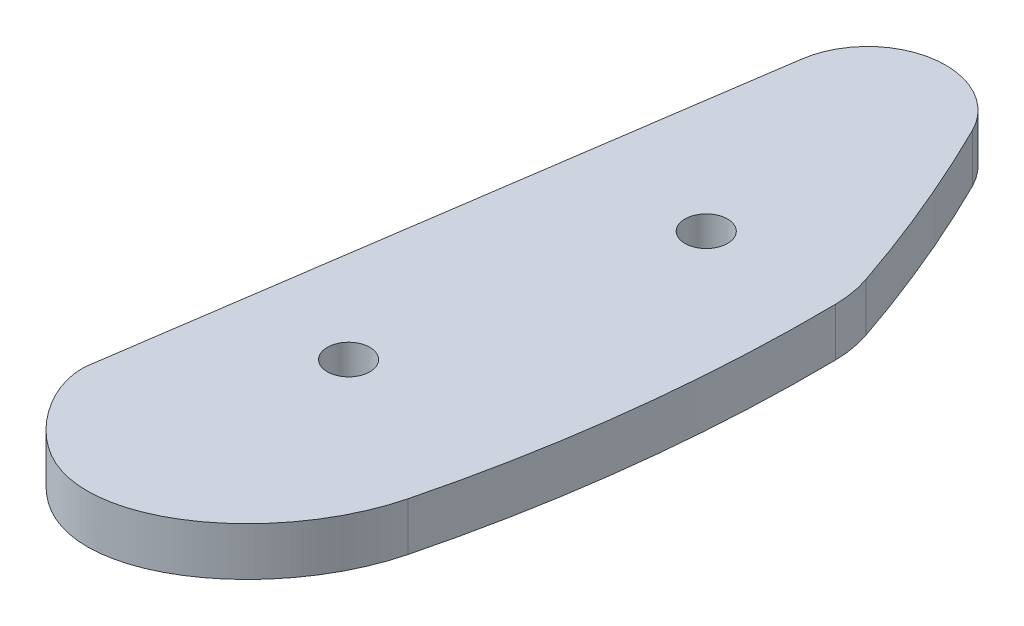
from build123d import *

# Parameters (mm, degrees)
BOSS_EXTRUDE2_DEPTH = 5
CUT_EXTRUDE1_REACH  = 176.937
SKETCH2_R           = 2.2


with BuildPart() as part:
    # Sketch1 → Boss-Extrude2 (new body)
    with BuildSketch(Plane(origin=(0, 0, 0), x_dir=(1, 0, 0), z_dir=(0, 1, 0))):
        with BuildLine():
            ThreePointArc((-26.256294904, 162.782156045), (-34.757388509, 167.168565439), (-41.482617684, 160.365590178))
            Line((-41.482617684, 160.365590178), (-50.932711484, 96.056215067))
            ThreePointArc((-50.932711484, 96.056215067), (-50.956557115, 95.796817406), (-50.979081843, 95.537301709))
            add(Edge.make_bspline(
                [(-22.456551163, 100.599709115), (-25.176477923, 89.862155319), (-41.371339617, 77.714728994), (-51.090796969, 92.352457993), (-50.979081843, 95.537301709)],
                knots=[0, 0, 0, 0, 0.694817922, 0.98396673, 0.98396673, 0.98396673, 0.98396673], degree=3))
            ThreePointArc((-22.456551163, 100.599709115), (-18.824269383, 120.221092129), (-17.76802696, 140.147870449))
            ThreePointArc((-17.76802696, 140.147870449), (-17.943181625, 142.067888002), (-18.417828761, 143.936539027))
            ThreePointArc((-18.417828761, 143.936539027), (-22.023480215, 153.489775682), (-26.256294904, 162.782156045))
        make_face()
    extrude(amount=BOSS_EXTRUDE2_DEPTH)

    # Sketch2 → Cut-Extrude1 (cut, up to next)
    with BuildSketch(Plane(origin=(0, 5, 0), x_dir=(1, 0, 0), z_dir=(0, 1, 0)), mode=Mode.PRIVATE) as cut_extrude1_sk1:
        with Locations(Location((-31, 140, 0), (0, 0, 270))):
            Circle(SKETCH2_R)
    cut_extrude1_tool1 = extrude(cut_extrude1_sk1.sketch, amount=-CUT_EXTRUDE1_REACH, mode=Mode.PRIVATE) & part.part
    # Sketch2 → Cut-Extrude1 (cut, up to next)
    with BuildSketch(Plane(origin=(0, 5, 0), x_dir=(1, 0, 0), z_dir=(0, 1, 0)), mode=Mode.PRIVATE) as cut_extrude1_sk2:
        with Locations(Location((-38, 110, 0), (0, 0, 270))):
            Circle(SKETCH2_R)
    cut_extrude1_tool2 = extrude(cut_extrude1_sk2.sketch, amount=-CUT_EXTRUDE1_REACH, mode=Mode.PRIVATE) & part.part
    add(cut_extrude1_tool1.solids().sort_by_distance((-31, 5, -140))[0], mode=Mode.SUBTRACT)
    add(cut_extrude1_tool2.solids().sort_by_distance((-38, 5, -110))[0], mode=Mode.SUBTRACT)


solid = part.part
